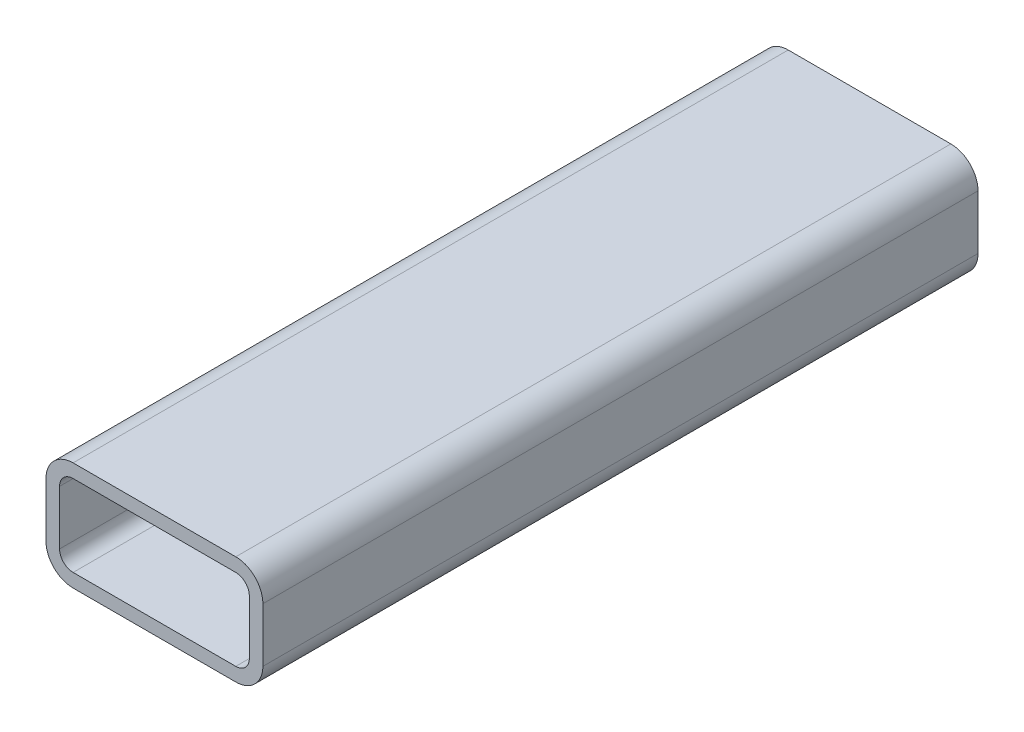
from build123d import *

# Parameters (mm, degrees)
BOSS_EXTRUDE1_DEPTH = 670


with BuildPart() as part:
    # Sketch1 → Boss-Extrude1 (new body)
    with BuildSketch(Plane.XY):
        with BuildLine():
            Line((-76.2, -50.8), (76.2, -50.8))
            ThreePointArc((76.2, -50.8), (94.160512242, -43.360512242), (101.6, -25.4))
            Line((101.6, -25.4), (101.6, 25.4))
            ThreePointArc((101.6, 25.4), (94.160512242, 43.360512242), (76.2, 50.8))
            Line((76.2, 50.8), (-76.2, 50.8))
            ThreePointArc((-76.2, 50.8), (-94.160512242, 43.360512242), (-101.6, 25.4))
            Line((-101.6, 25.4), (-101.6, -25.4))
            ThreePointArc((-101.6, -25.4), (-94.160512242, -43.360512242), (-76.2, -50.8))
        make_face()
        with BuildLine():
            Line((-76.2, -38.1), (76.2, -38.1))
            ThreePointArc((76.2, -38.1), (85.180256121, -34.380256121), (88.9, -25.4))
            Line((88.9, -25.4), (88.9, 25.4))
            ThreePointArc((88.9, 25.4), (85.180256121, 34.380256121), (76.2, 38.1))
            Line((76.2, 38.1), (-76.2, 38.1))
            ThreePointArc((-76.2, 38.1), (-85.180256121, 34.380256121), (-88.9, 25.4))
            Line((-88.9, 25.4), (-88.9, -25.4))
            ThreePointArc((-88.9, -25.4), (-85.180256121, -34.380256121), (-76.2, -38.1))
        make_face(mode=Mode.SUBTRACT)
    extrude(amount=BOSS_EXTRUDE1_DEPTH)


solid = part.part
